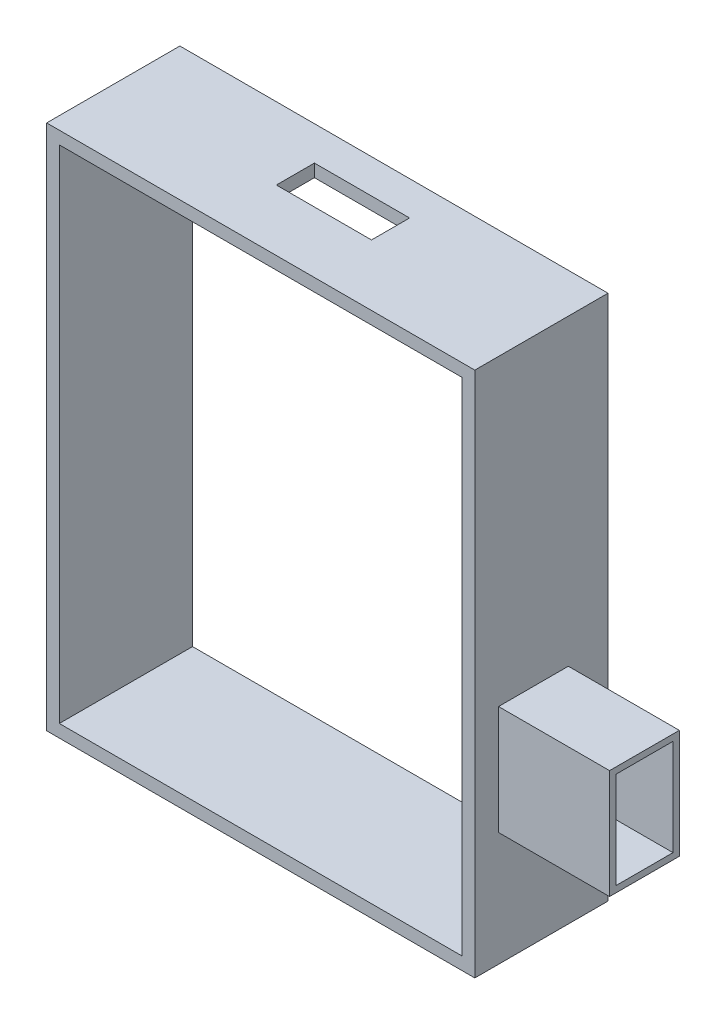
from build123d import *

# Parameters (mm, degrees)
SKETCH1_W           = 67.5
SKETCH1_H           = 83
SKETCH1_W_2         = 63.5
SKETCH1_H_2         = 79
BOSS_EXTRUDE1_DEPTH = 21
SKETCH2_W           = 11
SKETCH2_H           = 17.2
SKETCH2_W_2         = 9
SKETCH2_H_2         = 15.2
BOSS_EXTRUDE2_DEPTH = 17.5
SKETCH3_W           = 9
SKETCH3_H           = 15.2
CUT_EXTRUDE1_DEPTH  = 17
FILLET1_R           = 1
SKETCH4_W           = 15
SKETCH4_H           = 6
CUT_EXTRUDE2_DEPTH  = 12


with BuildPart() as part:
    # Sketch1 → Boss-Extrude1 (new body)
    with BuildSketch(Plane.XY):
        Rectangle(SKETCH1_W, SKETCH1_H)
        Rectangle(SKETCH1_W_2, SKETCH1_H_2, mode=Mode.SUBTRACT)
    extrude(amount=BOSS_EXTRUDE1_DEPTH)

    # Sketch2 → Boss-Extrude2 (add)
    with BuildSketch(Plane(origin=(33.75, 0, 0), x_dir=(0, 0, -1), z_dir=(1, 0, 0))):
        with Locations((-11.754556837, -14.907125753)):
            Rectangle(SKETCH2_W, SKETCH2_H)
        with Locations((-11.754556837, -14.907125753)):
            Rectangle(SKETCH2_W_2, SKETCH2_H_2, mode=Mode.SUBTRACT)
    extrude(amount=BOSS_EXTRUDE2_DEPTH)

    # Sketch3 → Cut-Extrude1 (cut)
    with BuildSketch(Plane(origin=(33.75, 0, 0), x_dir=(0, 0, -1), z_dir=(1, 0, 0))):
        with Locations((-11.754556837, -14.907125753)):
            Rectangle(SKETCH3_W, SKETCH3_H)
    extrude(amount=-CUT_EXTRUDE1_DEPTH, mode=Mode.SUBTRACT)

    # Fillet1
    fillet1_edges = [part.edges().sort_by_distance(p)[0] for p in [
        (31.75, -7.307125753, 11.754556837),
    ]]
    fillet(fillet1_edges, radius=FILLET1_R)

    # Sketch4 → Cut-Extrude2 (cut)
    with BuildSketch(Plane(origin=(0, 41.5, 0), x_dir=(1, 0, 0), z_dir=(0, 1, 0))):
        with Locations((0.339523704, -8.373101697)):
            Rectangle(SKETCH4_W, SKETCH4_H)
    extrude(amount=-CUT_EXTRUDE2_DEPTH, mode=Mode.SUBTRACT)


solid = part.part
